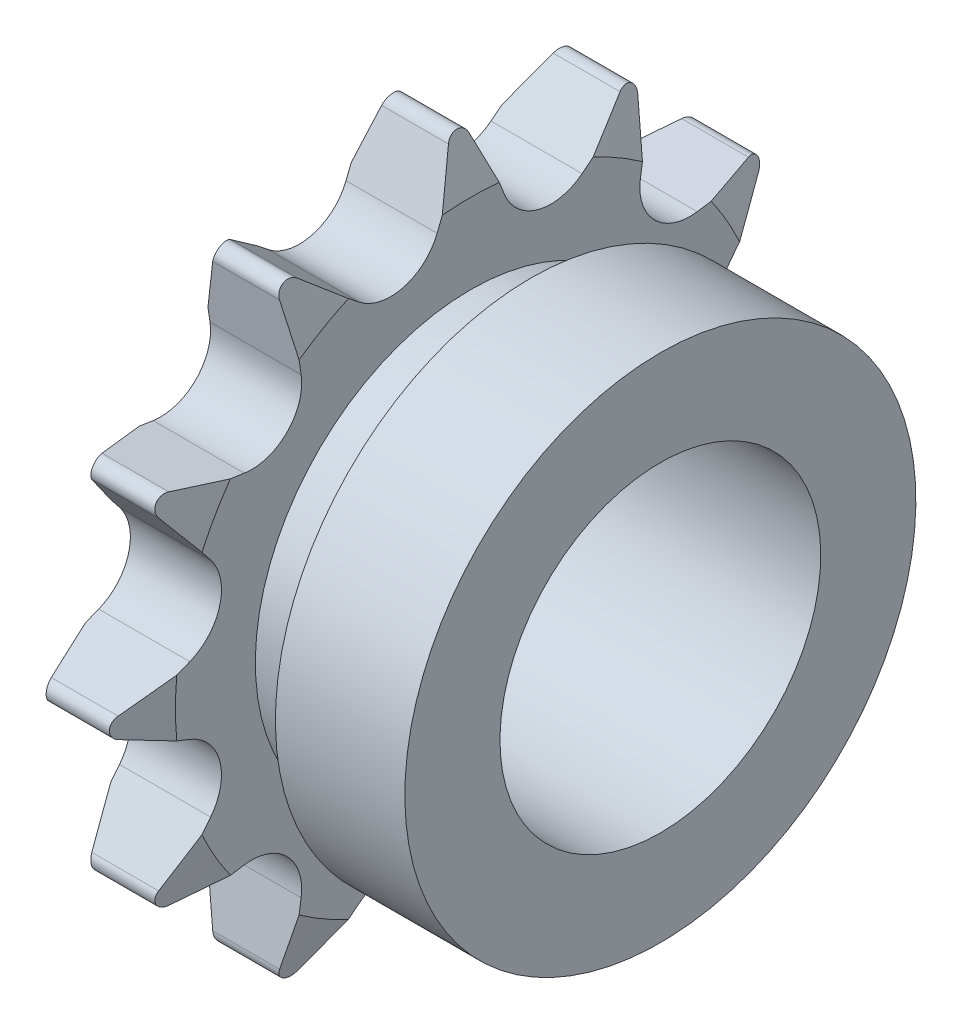
from build123d import *

# Parameters (mm, degrees)
SKETCH13_W         = 22.225
SKETCH13_H         = 27.5082
CUT_EXTRUDE1_DEPTH = 7.2136
CIRPATTERN1_COUNT  = 12
SKETCH15_W         = 127
SKETCH15_H         = 22.5171
SKETCH16_W         = 4.7625
SKETCH16_H         = 3.175
SKETCH34_R         = 12.7
CUT_EXTRUDE3_DEPTH = 45.803490606


with BuildPart() as part:
    # Sketch13 → Revolve1 (revolve)
    with BuildSketch(Plane.XY):
        with Locations((11.1125, 13.7541)):
            Rectangle(SKETCH13_W, SKETCH13_H)
    revolve(axis=Axis((0, 0, 0), (-1, 0, 0)))

    # Sketch6 → Cut-Extrude1 (cut)
    with BuildSketch(Plane(origin=(0, -16.51, 0), x_dir=(0, 0, -1), z_dir=(1, 0, 0))):
        with BuildLine():
            Line((-0.805715716, 43.469749783), (-2.663822441, 38.756002806))
            ThreePointArc((-2.663822441, 38.756002806), (-5.324614334, 36.381731224), (-8.816063498, 37.107514783))
            Line((-8.816063498, 37.107514783), (-12.782104613, 40.260686049))
            ThreePointArc((-12.782104613, 40.260686049), (-13.256994885, 40.44645554), (-13.7541, 40.332800012))
            ThreePointArc((-13.7541, 40.332800012), (-7.119646056, 43.080880815), (0, 44.0182))
            ThreePointArc((0, 44.0182), (-0.487333422, 43.868076017), (-0.805715716, 43.469749783))
        make_face()
    cut_extrude1 = extrude(amount=CUT_EXTRUDE1_DEPTH, mode=Mode.SUBTRACT)

    # CirPattern1: Cut-Extrude1 ×12 about axis
    cirpattern1_axis = Axis((0, 0, 0), (1, 0, 0))
    for i in range(1, CIRPATTERN1_COUNT):
        add(cut_extrude1.rotate(cirpattern1_axis, i * 360 / CIRPATTERN1_COUNT), mode=Mode.SUBTRACT)

    # Sketch15 → hub Cut-Revolve3 (revolve, cut)
    with BuildSketch(Plane.XY):
        with Locations((70.7136, 31.48965)):
            Rectangle(SKETCH15_W, SKETCH15_H)
        with Locations((-63.5, 31.48965)):
            Rectangle(SKETCH15_W, SKETCH15_H)
    revolve(axis=Axis((0, 0, 0), (-1, 0, 0)), mode=Mode.SUBTRACT)

    # Sketch4 → Teeth Chamfer (revolve, cut)
    with BuildSketch(Plane.XY):
        Polygon((0, 27.5082), (1.104501883, 27.5082), (0, 23.386142857), align=None)
        Polygon((7.2136, 27.5082), (6.109098117, 27.5082), (7.2136, 23.386142857), align=None)
    revolve(axis=Axis((0, 0, 0), (-1, 0, 0)), mode=Mode.SUBTRACT)

    # Sketch16 → Recess (revolve, cut)
    with BuildSketch(Plane.XY):
        with Locations((9.59485, 18.6436)):
            Rectangle(SKETCH16_W, SKETCH16_H)
    revolve(axis=Axis((0, 0, 0), (-1, 0, 0)), mode=Mode.SUBTRACT)

    # Sketch34 → Cut-Extrude3 (cut, through all)
    with BuildSketch(Plane(origin=(0, 0, 0), x_dir=(0, 0, -1), z_dir=(1, 0, 0))):
        with Locations(Location((0, 0, 0), (0, 0, 270))):
            Circle(SKETCH34_R)
    extrude(amount=CUT_EXTRUDE3_DEPTH, mode=Mode.SUBTRACT)


solid = part.part
